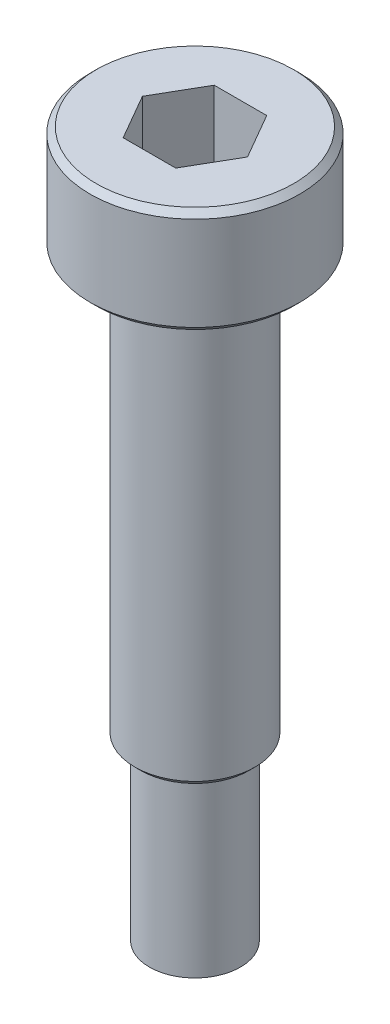
from build123d import *

# Parameters (mm, degrees)
CUT_EXTRUDE1_DEPTH = 2.4
CHAMFER1_SIZE      = 0.2


with BuildPart() as part:
    # Sketch1 → Revolve1 (revolve)
    with BuildSketch(Plane.XY, mode=Mode.PRIVATE) as revolve1_sk:
        Polygon((0, 0), (1.5, 0), (1.5, 5.75), (1.98, 5.75), (1.98, 19.75), (3.455, 19.75), (3.455, 23.24), (0, 23.24), align=None)
    revolve(revolve1_sk.sketch.rotate(Axis((0, 23.24, 0), (0, -1, 0)), 90), axis=Axis((0, 23.24, 0), (0, -1, 0)))

    # Sketch2 → Cut-Extrude1 (cut)
    with BuildSketch(Plane(origin=(0, 23.24, 0), x_dir=(1, 0, 0), z_dir=(0, 1, 0))):
        Polygon((1.732050808, 0), (0.866025404, 1.5), (-0.866025404, 1.5), (-1.732050808, 0), (-0.866025404, -1.5), (0.866025404, -1.5), align=None)
    extrude(amount=-CUT_EXTRUDE1_DEPTH, mode=Mode.SUBTRACT)

    # Chamfer1
    chamfer1_edges = [part.edges().sort_by_distance(p)[0] for p in [
        (0, 23.24, -3.455),
        (0, 19.75, -3.455),
        (0, 5.75, -1.98),
    ]]
    chamfer(chamfer1_edges, length=CHAMFER1_SIZE)


solid = part.part
